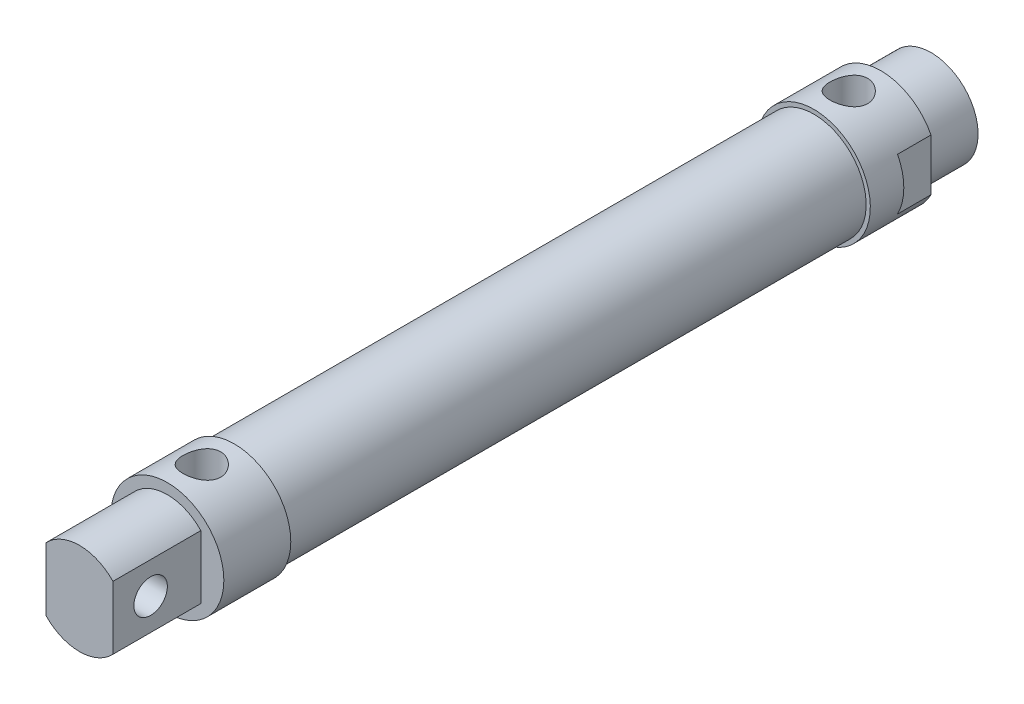
from build123d import *

# Parameters (mm, degrees)
SKETCH1_R           = 12.5
BOSS_EXTRUDE1_DEPTH = 138.5
SKETCH2_R           = 13.5
BOSS_EXTRUDE2_DEPTH = 37
BOSS_EXTRUDE3_START = 28
SKETCH3_R           = 13.5
BOSS_EXTRUDE3_DEPTH = 28
CUT_EXTRUDE1_START  = -21
CUT_EXTRUDE1_DEPTH  = 21
SKETCH5_R           = 4
CUT_EXTRUDE2_DEPTH  = 178.32667594
CUT_EXTRUDE4_START  = -21
CUT_EXTRUDE4_DEPTH  = 21
CUT_EXTRUDE5_DEPTH  = 20
SKETCH8_OUTSIDE_W   = 70.41
SKETCH8_OUTSIDE_H   = 70.41
SKETCH8_OUTSIDE_R   = 11.25
CUT_EXTRUDE6_DEPTH  = 12
SKETCH10_R          = 4.5
CUT_EXTRUDE7_DEPTH  = 12
SKETCH11_R          = 4
CUT_EXTRUDE8_DEPTH  = 12


with BuildPart() as part:
    # Sketch1 → Boss-Extrude1 (new body)
    with BuildSketch(Plane.XY):
        Circle(SKETCH1_R)
    extrude(amount=BOSS_EXTRUDE1_DEPTH)

    # Sketch2 → Boss-Extrude2 (add)
    with BuildSketch(Plane.XY.offset(138.5)):
        Circle(SKETCH2_R)
    extrude(amount=BOSS_EXTRUDE2_DEPTH)

    # Sketch3 → Boss-Extrude3 (add)
    with BuildSketch(Plane(origin=(0, 0, 0), x_dir=(-1, 0, 0), z_dir=(0, 0, -1)).offset(BOSS_EXTRUDE3_START)):
        with Locations(Location((0, 0, 0), (0, 0, 180))):
            Circle(SKETCH3_R)
    extrude(amount=-BOSS_EXTRUDE3_DEPTH)

    # Sketch4 → Cut-Extrude1 (cut)
    with BuildSketch(Plane.XY.offset(175.5).offset(CUT_EXTRUDE1_START)):
        with BuildLine():
            Line((-8, 10.874281585), (-8, -10.874281585))
            ThreePointArc((-8, -10.874281585), (-13.5, 0), (-8, 10.874281585))
        make_face()
        with BuildLine():
            Line((8, 10.874281585), (8, -10.874281585))
            ThreePointArc((8, -10.874281585), (13.5, 0), (8, 10.874281585))
        make_face()
    extrude(amount=CUT_EXTRUDE1_DEPTH, mode=Mode.SUBTRACT)

    # Sketch5 → Cut-Extrude2 (cut, through all)
    with BuildSketch(Plane.ZY.offset(8)):
        with Locations((166.5, 0)):
            Circle(SKETCH5_R)
    extrude(amount=-CUT_EXTRUDE2_DEPTH, mode=Mode.SUBTRACT)

    # Sketch6 → Cut-Extrude4 (cut)
    with BuildSketch(Plane.XY.offset(175.5).offset(CUT_EXTRUDE4_START)):
        with BuildLine():
            Line((8, 10.874281585), (8, 7.549834435))
            ThreePointArc((8, 7.549834435), (0, 11), (-8, 7.549834435))
            Line((-8, 7.549834435), (-8, 10.874281585))
            ThreePointArc((-8, 10.874281585), (0, 13.5), (8, 10.874281585))
        make_face()
        with BuildLine():
            Line((-8, -10.874281585), (-8, -7.549834435))
            ThreePointArc((-8, -7.549834435), (0, -11), (8, -7.549834435))
            Line((8, -7.549834435), (8, -10.874281585))
            ThreePointArc((8, -10.874281585), (0, -13.5), (-8, -10.874281585))
        make_face()
    extrude(amount=CUT_EXTRUDE4_DEPTH, mode=Mode.SUBTRACT)

    # Sketch7 → Cut-Extrude5 (cut)
    with BuildSketch(Plane(origin=(0, 0, -28), x_dir=(-1, 0, 0), z_dir=(0, 0, -1))):
        with BuildLine():
            Line((-12, 6.184658438), (-12, -6.184658438))
            ThreePointArc((-12, -6.184658438), (-13.5, 0), (-12, 6.184658438))
        make_face()
        with BuildLine():
            Line((12, 6.184658438), (12, -6.184658438))
            ThreePointArc((12, -6.184658438), (13.5, 0), (12, 6.184658438))
        make_face()
    extrude(amount=-CUT_EXTRUDE5_DEPTH, mode=Mode.SUBTRACT)

    # Sketch8 outside → Cut-Extrude6 (cut)
    with BuildSketch(Plane(origin=(0, 0, -28), x_dir=(-1, 0, 0), z_dir=(0, 0, -1))):
        Rectangle(SKETCH8_OUTSIDE_W, SKETCH8_OUTSIDE_H)
        Circle(SKETCH8_OUTSIDE_R, mode=Mode.SUBTRACT)
    extrude(amount=-CUT_EXTRUDE6_DEPTH, mode=Mode.SUBTRACT)

    # Sketch10 → Cut-Extrude7 (cut)
    with BuildSketch(Plane(origin=(0, 15, 0), x_dir=(-1, 0, 0), z_dir=(0, 1, 0))):
        with Locations(Location((0, 146.266828113, 0), (0, 0, 90))):
            Circle(SKETCH10_R)
        with Locations(Location((0, -8.332143665, 0), (0, 0, 90))):
            Circle(SKETCH10_R)
    extrude(amount=-CUT_EXTRUDE7_DEPTH, mode=Mode.SUBTRACT)

    # Sketch11 → Cut-Extrude8 (cut)
    with BuildSketch(Plane(origin=(0, 0, -28), x_dir=(-1, 0, 0), z_dir=(0, 0, -1))):
        Circle(SKETCH11_R)
    extrude(amount=-CUT_EXTRUDE8_DEPTH, mode=Mode.SUBTRACT)


solid = part.part
